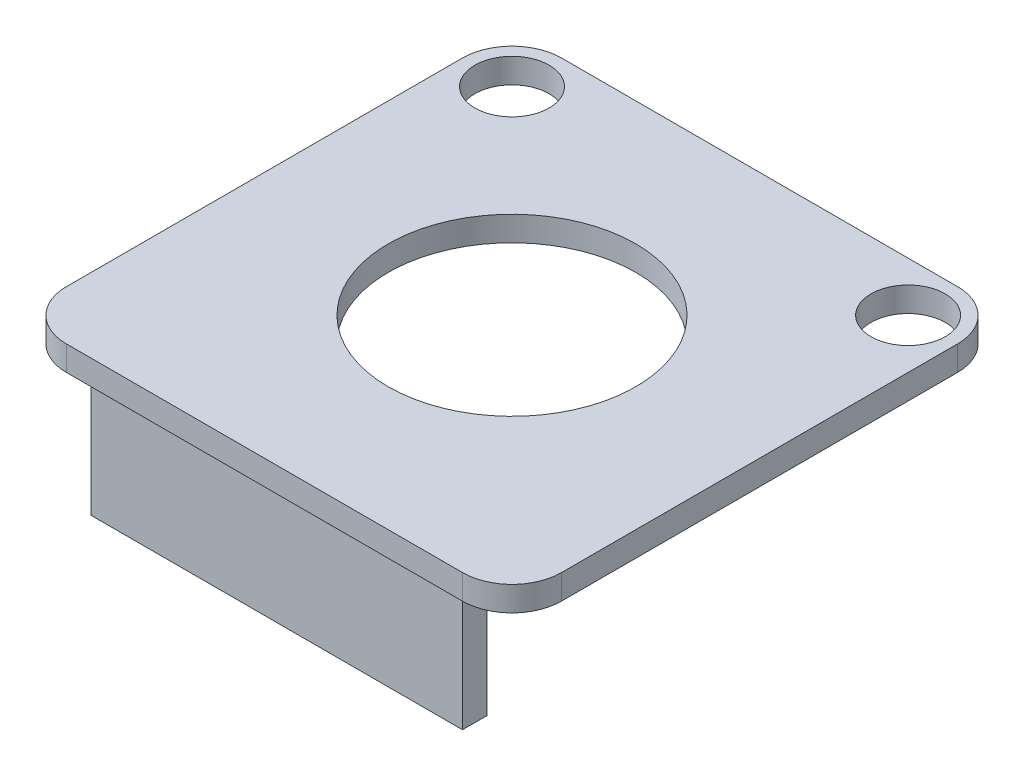
from build123d import *

# Parameters (mm, degrees)
SKETCH2_W           = 20
SKETCH2_H           = 20
BOSS_EXTRUDE1_DEPTH = 1
SKETCH3_R           = 5
SKETCH3_R_2         = 1.5
CUT_EXTRUDE1_DEPTH  = 15.177446879
FILLET1_R           = 2
SKETCH4_W           = 15
SKETCH4_H           = 1
BOSS_EXTRUDE2_DEPTH = 5


with BuildPart() as part:
    # Sketch2 → Boss-Extrude1 (new body)
    with BuildSketch(Plane(origin=(0, 0, 0), x_dir=(1, 0, 0), z_dir=(0, 1, 0))):
        Rectangle(SKETCH2_W, SKETCH2_H)
    extrude(amount=BOSS_EXTRUDE1_DEPTH)

    # Sketch3 → Cut-Extrude1 (cut, through all)
    with BuildSketch(Plane(origin=(0, 1, 0), x_dir=(1, 0, 0), z_dir=(0, 1, 0))):
        with Locations(Location((0, 0, 0), (0, 0, 270))):
            Circle(SKETCH3_R)
        with Locations(Location((-8, 8, 0), (0, 0, 270))):
            Circle(SKETCH3_R_2)
        with Locations(Location((8, 8, 0), (0, 0, 270))):
            Circle(SKETCH3_R_2)
    extrude(amount=-CUT_EXTRUDE1_DEPTH, mode=Mode.SUBTRACT)

    # Fillet1
    fillet1_edges = [part.edges().sort_by_distance(p)[0] for p in [
        (10, 0.5, 10),
        (-10, 0.5, 10),
        (-10, 0.5, -10),
        (10, 0.5, -10),
    ]]
    fillet(fillet1_edges, radius=FILLET1_R)

    # Sketch4 → Boss-Extrude2 (add)
    with BuildSketch(Plane.XZ):
        with Locations((0, 9)):
            Rectangle(SKETCH4_W, SKETCH4_H)
    extrude(amount=BOSS_EXTRUDE2_DEPTH)


solid = part.part
